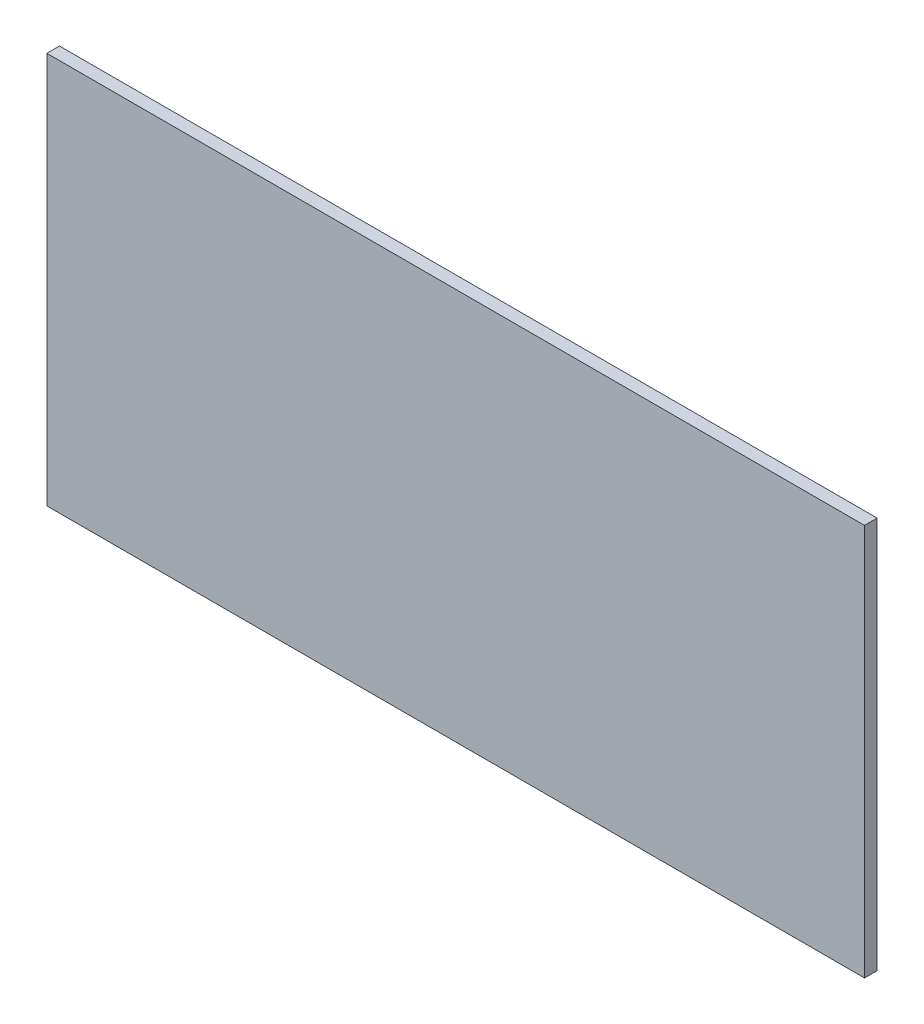
from build123d import *

# Parameters (mm, degrees)
SKETCH1_W     = 194
SKETCH1_H     = 93
PROFILE_DEPTH = 3


with BuildPart() as part:
    # Sketch1 → Profile (new body)
    with BuildSketch(Plane.XY):
        with Locations((97, 46.5)):
            Rectangle(SKETCH1_W, SKETCH1_H)
    extrude(amount=PROFILE_DEPTH)


solid = part.part
